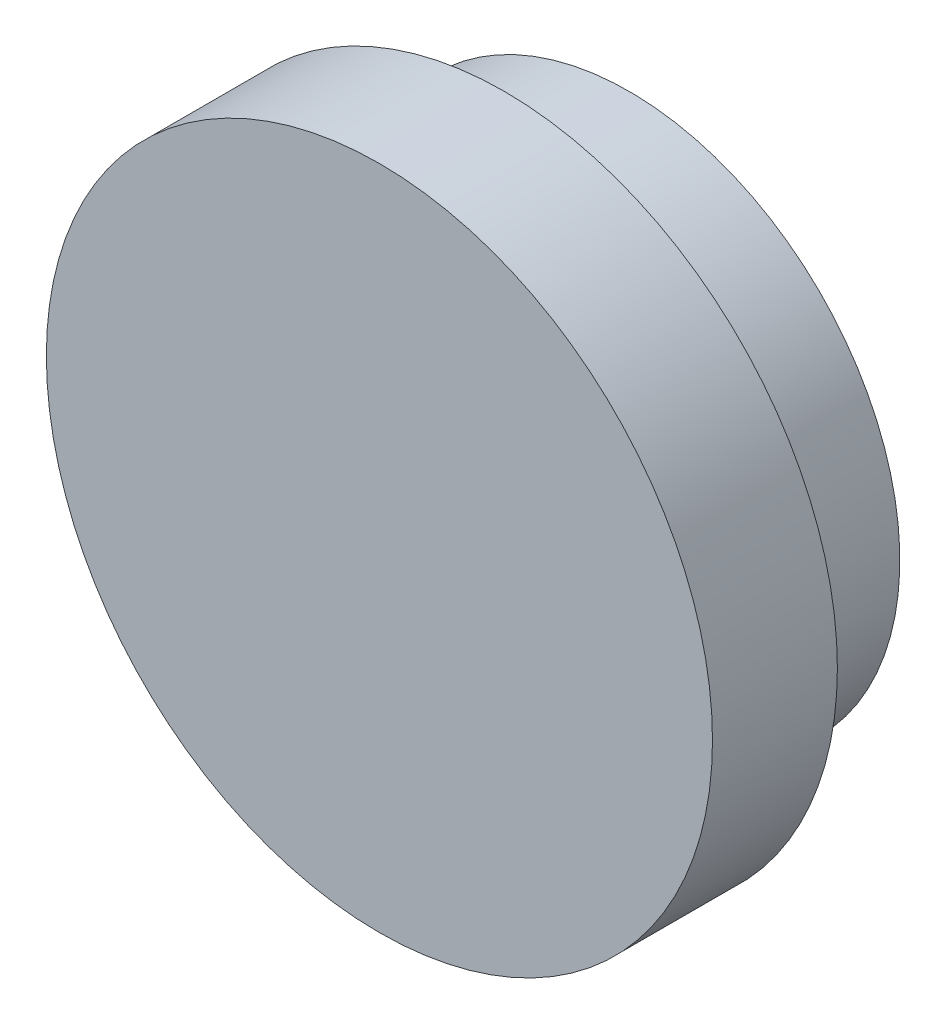
from build123d import *


with BuildPart() as part:
    # Sketch1 → Revolve1 (revolve)
    with BuildSketch(Plane(origin=(0, 0, 0), x_dir=(0, 0, -1), z_dir=(1, 0, 0)), mode=Mode.PRIVATE) as revolve1_sk:
        Polygon((0, 8), (3, 8), (3, 6.5), (6, 6.5), (6, 0), (0, 0), align=None)
    revolve(revolve1_sk.sketch.rotate(Axis((0, 0, -6), (0, 0, 1)), 90), axis=Axis((0, 0, -6), (0, 0, 1)))


solid = part.part
